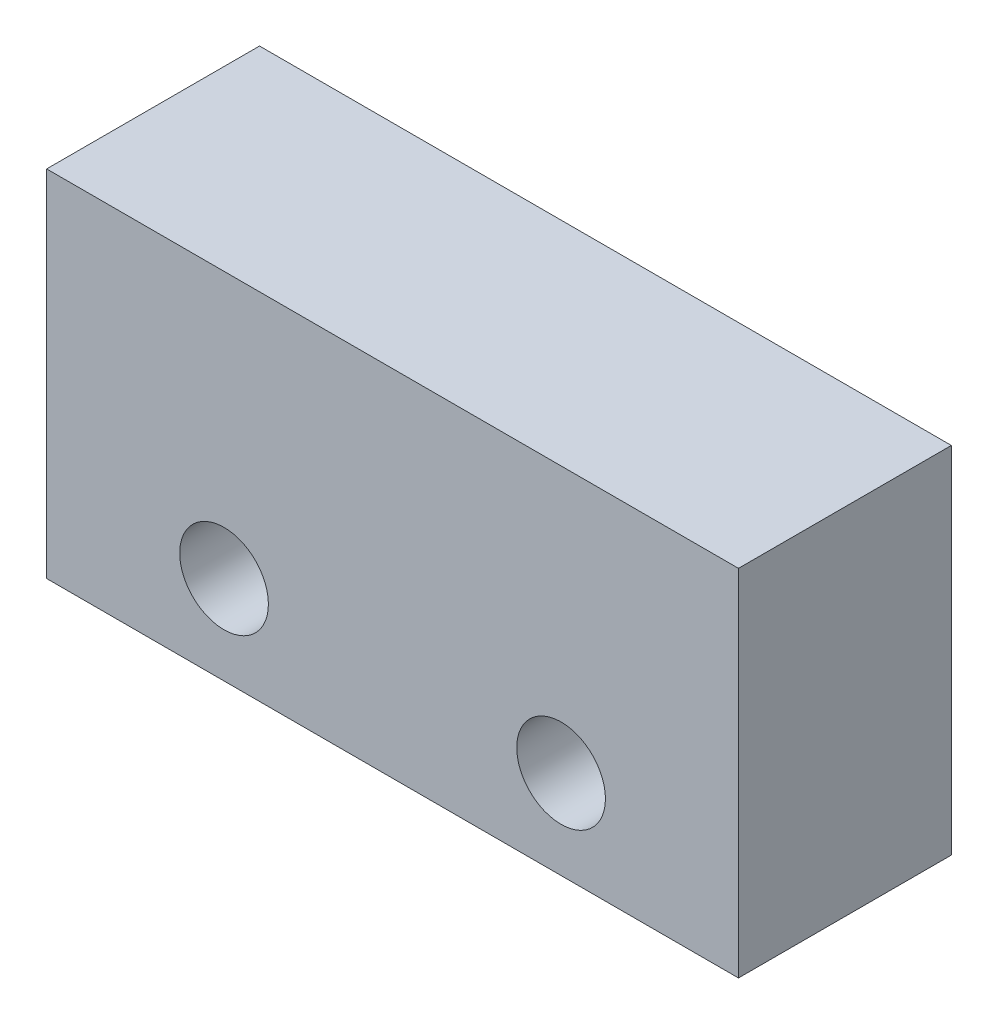
from build123d import *

# Parameters (mm, degrees)
SKETCH2_W           = 19.5
SKETCH2_H           = 10
SKETCH2_R           = 1.25
BOSS_EXTRUDE1_DEPTH = 3


with BuildPart() as part:
    # Sketch2 → Boss-Extrude1 (new, symmetric)
    with BuildSketch(Plane.XY):
        Rectangle(SKETCH2_W, SKETCH2_H)
        with Locations((-4.75, -2.5)):
            Circle(SKETCH2_R, mode=Mode.SUBTRACT)
        with Locations((4.75, -2.5)):
            Circle(SKETCH2_R, mode=Mode.SUBTRACT)
    extrude(amount=BOSS_EXTRUDE1_DEPTH, both=True)


solid = part.part
